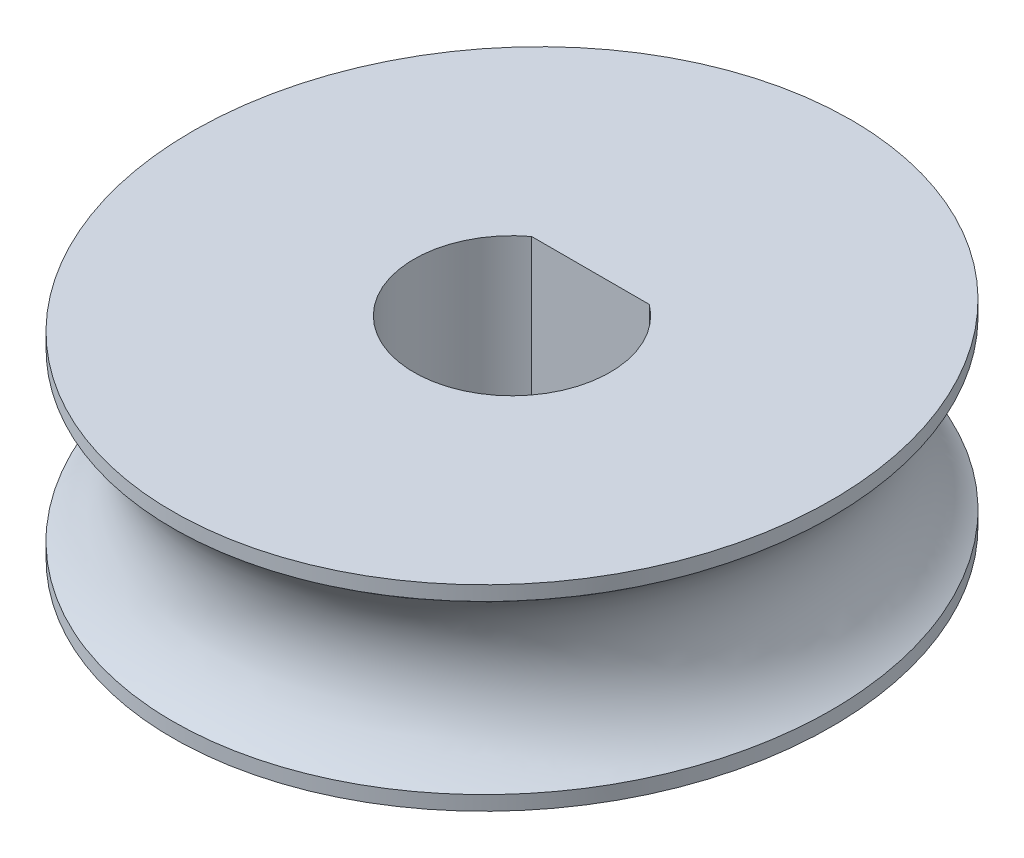
from build123d import *

# Parameters (mm, degrees)
SKETCH1_RX           = 10
SKETCH1_RY           = 9.5
BOSS_EXTRUDE1_DEPTH  = 5
CUT_SWEEP3_PROFILE_R = 2.525
CUT_EXTRUDE1_DEPTH   = 10


with BuildPart() as part:
    # Sketch1 → Boss-Extrude1 (new body)
    with BuildSketch(Plane(origin=(0, 0, 0), x_dir=(1, 0, 0), z_dir=(0, 1, 0))):
        with Locations(Location((0, 0), (0, 0, -90))):
            Ellipse(SKETCH1_RX, SKETCH1_RY)
        with BuildLine():
            Line((1.5, 2), (-1.5, 2))
            ThreePointArc((-1.5, 2), (0, -2.5), (1.5, 2))
        make_face(mode=Mode.SUBTRACT)
    extrude(amount=BOSS_EXTRUDE1_DEPTH)

    # Cut-Sweep3: sweep along a path in Sketch2
    with BuildLine(Plane(origin=(0, 2.5, 0), x_dir=(1, 0, 0), z_dir=(0, 1, 0))) as cut_sweep3_path:
        EllipticalCenterArc((0, 0), 10, 9.5, start_angle=0, arc_size=360, rotation=90)
    # Cut-Sweep3 profile (on start of the path) → Cut-Sweep3 (sweep, cut)
    with BuildSketch(Plane(origin=(0, 2.5, -10), x_dir=(0, 0, -1), z_dir=(-1, 0, 0))):
        Circle(CUT_SWEEP3_PROFILE_R)
    sweep(path=cut_sweep3_path.line, mode=Mode.SUBTRACT)

    # Sketch27 → Cut-Extrude1 (cut)
    with BuildSketch(Plane(origin=(0, 5, 0), x_dir=(1, 0, 0), z_dir=(0, 1, 0))):
        with BuildLine():
            add(Edge.make_bspline(
                [(0, 9.645563828), (-0.758503038, 9.645564212), (-1.517286769, 9.565936878), (-2.265269624, 9.406585941), (-2.992455116, 9.170179622), (-3.689674481, 8.860976866), (-4.696144743, 8.287182833), (-5.033026907, 8.070588817), (-5.358216994, 7.836342416), (-5.670696822, 7.585404274), (-5.969566199, 7.318802839), (-6.549656622, 6.745390623), (-6.829730147, 6.43740695), (-7.093360483, 6.114870941), (-7.339798208, 5.779026576), (-7.568414863, 5.431140244), (-7.915330171, 4.839411915), (-8.044227667, 4.601789408), (-8.165234512, 4.359968222), (-8.278225476, 4.114297866), (-8.383092616, 3.865127725), (-8.544534604, 3.443668275), (-8.605632529, 3.273113696), (-8.663011537, 3.101248396), (-8.716647121, 2.92817725), (-8.766517763, 2.75400493), (-8.923174946, 2.158579308), (-9.01196691, 1.732587012), (-9.078724913, 1.302299066), (-9.123283905, 0.869151703), (-9.145563846, 0.434576578), (-9.145564011, -0.615715948), (-9.100839273, -1.23142422), (-9.011395422, -1.843077139), (-8.877549469, -2.446595628), (-8.699974619, -3.037877718), (-8.383092616, -3.865127725), (-8.278225476, -4.114297866), (-8.165234512, -4.359968222), (-8.044227667, -4.601789408), (-7.915330171, -4.839411915), (-7.568414863, -5.431140244), (-7.339798208, -5.779026576), (-7.093360483, -6.114870941), (-6.829730147, -6.43740695), (-6.549656622, -6.745390623), (-5.969566199, -7.318802839), (-5.670696822, -7.585404274), (-5.358216994, -7.836342416), (-5.033026907, -8.070588817), (-4.696144743, -8.287182833), (-4.13905593, -8.604782026), (-3.925549732, -8.717568059), (-3.7084536, -8.823417013), (-3.488032874, -8.922152617), (-3.264566937, -9.013614419), (-2.553432563, -9.27781212), (-2.055830142, -9.423897373), (-1.548503321, -9.534463128), (-1.034563212, -9.608533948), (-0.517259644, -9.645563847), (0.363597835, -9.645563938), (0.727203338, -9.627266619), (1.0896503, -9.590672341), (1.449798692, -9.53590758), (1.806534427, -9.463219718), (2.307638251, -9.334829516), (2.455704757, -9.29355013), (2.602887518, -9.249161075), (2.749107212, -9.201692908), (2.894286337, -9.151179449), (3.264566937, -9.013614419), (3.488032874, -8.922152617), (3.7084536, -8.823417013), (3.925549732, -8.717568059), (4.13905593, -8.604782026), (4.696144743, -8.287182833), (5.033026907, -8.070588817), (5.358216994, -7.836342416), (5.670696822, -7.585404274), (5.969566199, -7.318802839), (6.549656622, -6.745390623), (6.829730147, -6.43740695), (7.093360483, -6.114870941), (7.339798208, -5.779026576), (7.568414863, -5.431140244), (7.915330171, -4.839411915), (8.044227667, -4.601789408), (8.165234512, -4.359968222), (8.278225476, -4.114297866), (8.383092616, -3.865127725), (8.544534604, -3.443668275), (8.605632529, -3.273113696), (8.663011537, -3.101248396), (8.716647121, -2.92817725), (8.766517763, -2.75400493), (8.923174946, -2.158579308), (9.01196691, -1.732587012), (9.078724913, -1.302299066), (9.123283905, -0.869151703), (9.145563846, -0.434576578), (9.145564011, 0.615715948), (9.100839273, 1.23142422), (9.011395422, 1.843077139), (8.877549469, 2.446595628), (8.699974619, 3.037877718), (8.383092616, 3.865127725), (8.278225476, 4.114297866), (8.165234512, 4.359968222), (8.044227667, 4.601789408), (7.915330171, 4.839411915), (7.568414863, 5.431140244), (7.339798208, 5.779026576), (7.093360483, 6.114870941), (6.829730147, 6.43740695), (6.549656622, 6.745390623), (5.969566199, 7.318802839), (5.670696822, 7.585404274), (5.358216994, 7.836342416), (5.033026907, 8.070588817), (4.696144743, 8.287182833), (3.689674481, 8.860976866), (2.992455116, 9.170179622), (2.265269624, 9.406585941), (1.517286769, 9.565936878), (0.758503038, 9.645564212), (0, 9.645563828)],
                knots=[0, 0, 0, 0, 0, 0, 0, 0.077105522, 0.077105522, 0.077105522, 0.077105522, 0.077105522, 0.117752543, 0.117752543, 0.117752543, 0.117752543, 0.117752543, 0.159994987, 0.159994987, 0.159994987, 0.159994987, 0.159994987, 0.187446594, 0.187446594, 0.187446594, 0.187446594, 0.187446594, 0.205848296, 0.205848296, 0.205848296, 0.205848296, 0.205848296, 0.249996723, 0.249996723, 0.249996723, 0.249996723, 0.249996723, 0.312546989, 0.312546989, 0.312546989, 0.312546989, 0.312546989, 0.339998577, 0.339998577, 0.339998577, 0.339998577, 0.339998577, 0.382240994, 0.382240994, 0.382240994, 0.382240994, 0.382240994, 0.422887987, 0.422887987, 0.422887987, 0.422887987, 0.422887987, 0.447417833, 0.447417833, 0.447417833, 0.447417833, 0.447417833, 0.499999598, 0.499999598, 0.499999598, 0.499999598, 0.499999598, 0.536960946, 0.536960946, 0.536960946, 0.536960946, 0.536960946, 0.552582358, 0.552582358, 0.552582358, 0.552582358, 0.552582358, 0.577112212, 0.577112212, 0.577112212, 0.577112212, 0.577112212, 0.617759218, 0.617759218, 0.617759218, 0.617759218, 0.617759218, 0.660001648, 0.660001648, 0.660001648, 0.660001648, 0.660001648, 0.687453245, 0.687453245, 0.687453245, 0.687453245, 0.687453245, 0.705854941, 0.705854941, 0.705854941, 0.705854941, 0.705854941, 0.750003353, 0.750003353, 0.750003353, 0.750003353, 0.750003353, 0.812553596, 0.812553596, 0.812553596, 0.812553596, 0.812553596, 0.840005175, 0.840005175, 0.840005175, 0.840005175, 0.840005175, 0.882247577, 0.882247577, 0.882247577, 0.882247577, 0.882247577, 0.922894556, 0.922894556, 0.922894556, 0.922894556, 0.922894556, 1, 1, 1, 1, 1, 1, 1], degree=6))
        make_face()
        with BuildLine():
            add(Edge.make_bspline(
                [(0, 8.645563828), (-14.108530406, 8.645563828), (-7.054265203, -4.322781914), (0, -17.291127656), (7.054265203, -4.322781914), (14.108530406, 8.645563828), (0, 8.645563828)],
                knots=[0, 0, 0, 2.094395102, 2.094395102, 4.188790205, 4.188790205, 6.283185307, 6.283185307, 6.283185307], degree=2, weights=[1, 0.5, 1, 0.5, 1, 0.5, 1]))
        make_face(mode=Mode.SUBTRACT)
    extrude(amount=-CUT_EXTRUDE1_DEPTH, mode=Mode.SUBTRACT)


solid = part.part
